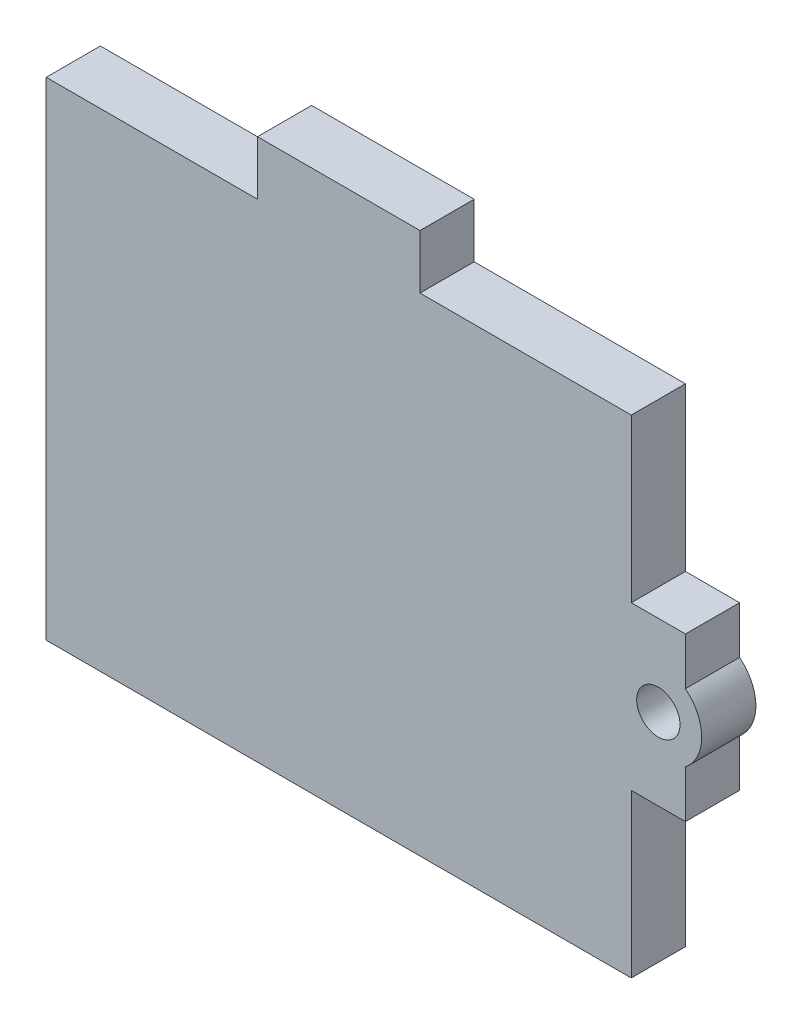
from build123d import *

# Parameters (mm, degrees)
SKETCH1_W           = 54
SKETCH1_H           = 45
BOSS_EXTRUDE1_DEPTH = 5
SKETCH3_W           = 5
SKETCH3_H           = 15
SKETCH3_W_2         = 15
SKETCH3_H_2         = 5
BOSS_EXTRUDE2_DEPTH = 5
SKETCH4_R           = 2
CUT_EXTRUDE1_DEPTH  = 5
SKETCH5_R           = 4
SKETCH5_R_2         = 2
BOSS_EXTRUDE3_DEPTH = 5


with BuildPart() as part:
    # Sketch1 → Boss-Extrude1 (new body)
    with BuildSketch(Plane.XY):
        Rectangle(SKETCH1_W, SKETCH1_H)
    extrude(amount=BOSS_EXTRUDE1_DEPTH)

    # Sketch3 → Boss-Extrude2 (add)
    with BuildSketch(Plane.XY.offset(5)):
        with Locations((29.5, 0)):
            Rectangle(SKETCH3_W, SKETCH3_H)
        with Locations((0, 25)):
            Rectangle(SKETCH3_W_2, SKETCH3_H_2)
    extrude(amount=-BOSS_EXTRUDE2_DEPTH)

    # Sketch4 → Cut-Extrude1 (cut)
    with BuildSketch(Plane.XY.offset(5)):
        with Locations((29.5, 0)):
            Circle(SKETCH4_R)
    extrude(amount=-CUT_EXTRUDE1_DEPTH, mode=Mode.SUBTRACT)

    # Sketch5 → Boss-Extrude3 (add)
    with BuildSketch(Plane.XY.offset(5)):
        with Locations((29.5, 0)):
            Circle(SKETCH5_R)
        with Locations((29.5, 0)):
            Circle(SKETCH5_R_2, mode=Mode.SUBTRACT)
    extrude(amount=-BOSS_EXTRUDE3_DEPTH)


solid = part.part
